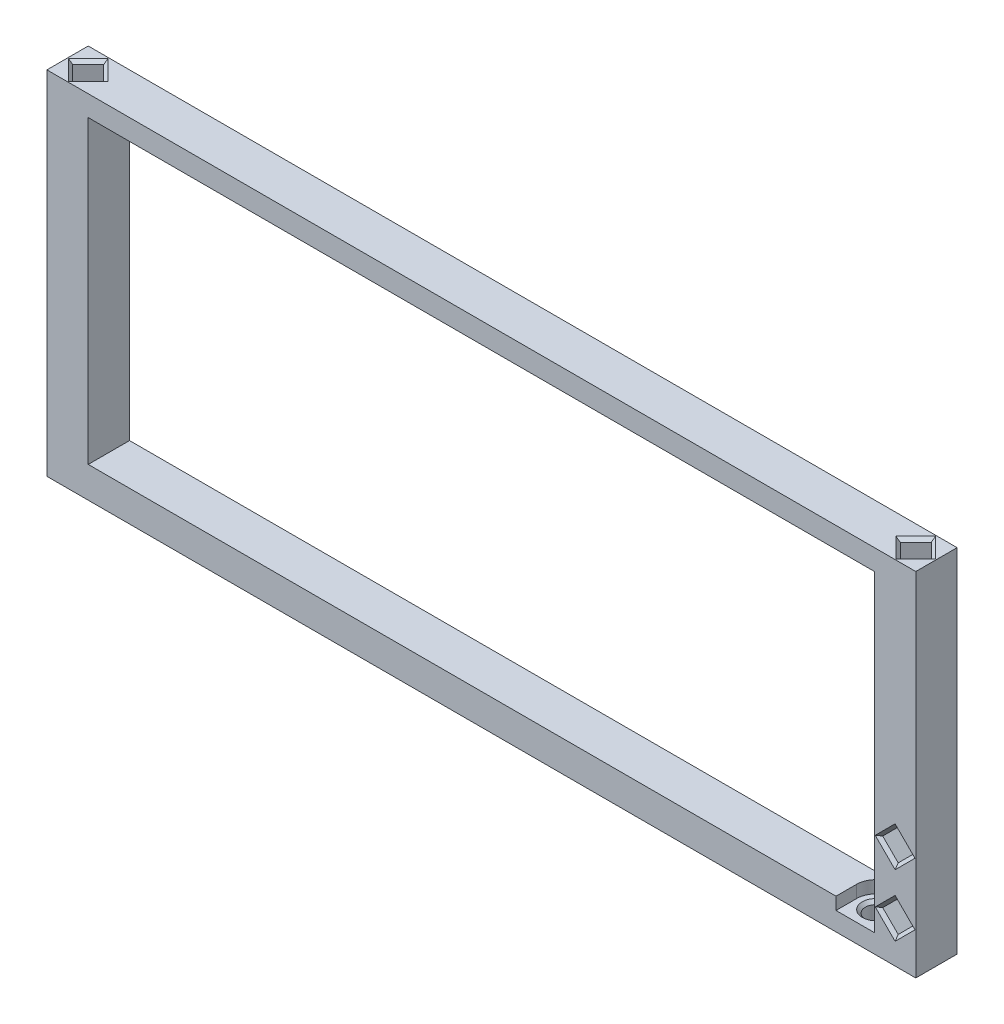
from build123d import *

# Parameters (mm, degrees)
SKETCH1_W                              = 178.0009902
SKETCH1_H                              = 72.120000116
SKETCH1_W_2                            = 161.067656866
SKETCH1_H_2                            = 61.536666783
BOSS_EXTRUDE1_DEPTH                    = 8.466666667
CUT_EXTRUDE1_DEPTH                     = 5.08
CUT_EXTRUDE2_DEPTH                     = 5.08
CUT_EXTRUDE3_DEPTH                     = 5.08
CUT_EXTRUDE4_DEPTH                     = 5.08
CHAMFER1_SIZE                          = 0.635
CUT_EXTRUDE5_DEPTH                     = 2.54
F_18_0_1695_DIAMETER_HOLE1_D           = 4.3053
F_18_0_1695_DIAMETER_HOLE1_DEPTH       = 3.81
F_18_0_1695_DIAMETER_HOLE1_CSINK_D     = 5.5753
F_18_0_1695_DIAMETER_HOLE1_CSINK_ANGLE = 90


with BuildPart() as part:
    # Sketch1 → Boss-Extrude1 (new body)
    with BuildSketch(Plane.XY):
        Rectangle(SKETCH1_W, SKETCH1_H)
        with Locations((0, 1.058333334)):
            Rectangle(SKETCH1_W_2, SKETCH1_H_2, mode=Mode.SUBTRACT)
    extrude(amount=BOSS_EXTRUDE1_DEPTH)

    # Sketch2 → Cut-Extrude1 (cut)
    with BuildSketch(Plane(origin=(0, 36.060000058, 0), x_dir=(1, 0, 0), z_dir=(0, 1, 0))):
        Polygon((-87.942161767, -4.233333333), (-84.767161767, -1.058333333), (-81.592161767, -4.233333333), (-84.767161767, -7.408333333), align=None)
        Polygon((81.592161767, -4.233333333), (84.767161767, -1.058333333), (87.942161767, -4.233333333), (84.767161767, -7.408333333), align=None)
    extrude(amount=-CUT_EXTRUDE1_DEPTH, mode=Mode.SUBTRACT)

    # Sketch3 → Cut-Extrude2 (cut)
    with BuildSketch(Plane.XY.offset(8.466666667)):
        Polygon((81.592161767, -27.593333392), (84.767161767, -24.418333392), (87.942161767, -27.593333392), (84.767161767, -30.768333392), align=None)
        Polygon((84.767161767, -11.718333392), (87.942161767, -14.893333392), (84.767161767, -18.068333392), (81.592161767, -14.893333392), align=None)
    extrude(amount=-CUT_EXTRUDE2_DEPTH, mode=Mode.SUBTRACT)

    # Sketch4 → Cut-Extrude3 (cut)
    with BuildSketch(Plane.ZY.offset(89.0004951)):
        Polygon((1.058333333, 27.593333392), (4.233333333, 30.768333392), (7.408333333, 27.593333392), (4.233333333, 24.418333392), align=None)
        Polygon((1.058333333, -27.593333392), (4.233333333, -24.418333392), (7.408333333, -27.593333392), (4.233333333, -30.768333392), align=None)
    extrude(amount=-CUT_EXTRUDE3_DEPTH, mode=Mode.SUBTRACT)

    # Sketch5 → Cut-Extrude4 (cut)
    with BuildSketch(Plane.XZ.offset(36.060000058)):
        Polygon((81.592161767, 4.233333333), (84.767161767, 7.408333333), (87.942161767, 4.233333333), (84.767161767, 1.058333333), align=None)
    extrude(amount=-CUT_EXTRUDE4_DEPTH, mode=Mode.SUBTRACT)

    # Chamfer1
    chamfer1_edges = [part.edges().sort_by_distance(p)[0] for p in [
        (83.179661767, -30.980000058, 2.645833333),
        (83.179661767, -30.980000058, 5.820833333),
        (86.354661767, -30.980000058, 5.820833333),
        (86.354661767, -30.980000058, 2.645833333),
        (83.179661767, -36.060000058, 2.645833333),
        (86.354661767, -36.060000058, 2.645833333),
        (86.354661767, -36.060000058, 5.820833333),
        (83.179661767, -36.060000058, 5.820833333),
        (-86.354661767, 30.980000058, 5.820833333),
        (-86.354661767, 30.980000058, 2.645833333),
        (-83.179661767, 30.980000058, 2.645833333),
        (-83.179661767, 30.980000058, 5.820833333),
        (-86.354661767, 36.060000058, 5.820833333),
        (-83.179661767, 36.060000058, 5.820833333),
        (-83.179661767, 36.060000058, 2.645833333),
        (-86.354661767, 36.060000058, 2.645833333),
        (83.179661767, 30.980000058, 5.820833333),
        (83.179661767, 30.980000058, 2.645833333),
        (86.354661767, 30.980000058, 2.645833333),
        (86.354661767, 30.980000058, 5.820833333),
        (83.179661767, 36.060000058, 5.820833333),
        (86.354661767, 36.060000058, 5.820833333),
        (86.354661767, 36.060000058, 2.645833333),
        (83.179661767, 36.060000058, 2.645833333),
        (83.179661767, -29.180833392, 3.386666667),
        (83.179661767, -26.005833392, 3.386666667),
        (86.354661767, -26.005833392, 3.386666667),
        (86.354661767, -29.180833392, 3.386666667),
        (83.179661767, -29.180833392, 8.466666667),
        (86.354661767, -29.180833392, 8.466666667),
        (86.354661767, -26.005833392, 8.466666667),
        (83.179661767, -26.005833392, 8.466666667),
        (83.179661767, -13.305833392, 3.386666667),
        (86.354661767, -13.305833392, 3.386666667),
        (86.354661767, -16.480833392, 3.386666667),
        (83.179661767, -16.480833392, 3.386666667),
        (83.179661767, -13.305833392, 8.466666667),
        (83.179661767, -16.480833392, 8.466666667),
        (86.354661767, -16.480833392, 8.466666667),
        (86.354661767, -13.305833392, 8.466666667),
        (-83.9204951, 26.005833392, 2.645833333),
        (-83.9204951, 29.180833392, 2.645833333),
        (-83.9204951, 29.180833392, 5.820833333),
        (-83.9204951, 26.005833392, 5.820833333),
        (-89.0004951, 26.005833392, 2.645833333),
        (-89.0004951, 26.005833392, 5.820833333),
        (-89.0004951, 29.180833392, 5.820833333),
        (-89.0004951, 29.180833392, 2.645833333),
        (-83.9204951, -29.180833392, 2.645833333),
        (-83.9204951, -26.005833392, 2.645833333),
        (-83.9204951, -26.005833392, 5.820833333),
        (-83.9204951, -29.180833392, 5.820833333),
        (-89.0004951, -29.180833392, 2.645833333),
        (-89.0004951, -29.180833392, 5.820833333),
        (-89.0004951, -26.005833392, 5.820833333),
        (-89.0004951, -26.005833392, 2.645833333),
    ]]
    chamfer(chamfer1_edges, length=CHAMFER1_SIZE)

    # Sketch6 → Cut-Extrude5 (cut)
    with BuildSketch(Plane(origin=(0, -29.710000058, 0), x_dir=(1, 0, 0), z_dir=(0, 1, 0))):
        with BuildLine():
            Line((72.659828433, -4.233333249), (72.659828433, -8.466666667))
            Line((72.659828433, -8.466666667), (80.533828433, -8.466666667))
            Line((80.533828433, -8.466666667), (80.533828433, -4.233333249))
            ThreePointArc((80.533828433, -4.233333249), (76.596828433, -0.296333249), (72.659828433, -4.233333249))
        make_face()
    extrude(amount=-CUT_EXTRUDE5_DEPTH, mode=Mode.SUBTRACT)

    # #18 (0.1695) Diameter Hole1
    with Locations(Plane(origin=(0, -32.250000058, 0), x_dir=(1, 0, 0), z_dir=(0, 1, 0))):
        with Locations((76.596828433, -4.233333249)):
            CounterSinkHole(F_18_0_1695_DIAMETER_HOLE1_D / 2, F_18_0_1695_DIAMETER_HOLE1_CSINK_D / 2, depth=F_18_0_1695_DIAMETER_HOLE1_DEPTH, counter_sink_angle=F_18_0_1695_DIAMETER_HOLE1_CSINK_ANGLE)


solid = part.part
